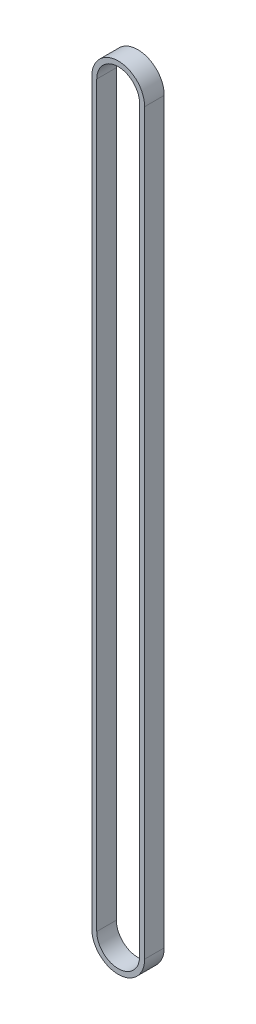
from build123d import *

# Parameters (mm, degrees)
BOSS_EXTRUDE1_DEPTH = 7.5


with BuildPart() as part:
    # Sketch1 → Boss-Extrude1 (new, symmetric)
    with BuildSketch(Plane(origin=(0, 0, -220.55), x_dir=(-1, 0, 0), z_dir=(0, 0, -1))):
        with BuildLine():
            Line((173.4478, 78.3), (173.4478, 643.313999882))
            ThreePointArc((173.4478, 643.313999882), (193.675, 663.541199882), (213.9022, 643.313999882))
            Line((213.9022, 643.313999882), (213.9022, 78.3))
            ThreePointArc((213.9022, 78.3), (193.675, 58.0728), (173.4478, 78.3))
        make_face()
        with BuildLine():
            Line((177.2578, 78.3), (177.2578, 643.313999882))
            ThreePointArc((177.2578, 643.313999882), (193.675, 659.731199882), (210.0922, 643.313999882))
            Line((210.0922, 643.313999882), (210.0922, 78.3))
            ThreePointArc((210.0922, 78.3), (193.675, 61.8828), (177.2578, 78.3))
        make_face(mode=Mode.SUBTRACT)
    extrude(amount=BOSS_EXTRUDE1_DEPTH, both=True)


solid = part.part
